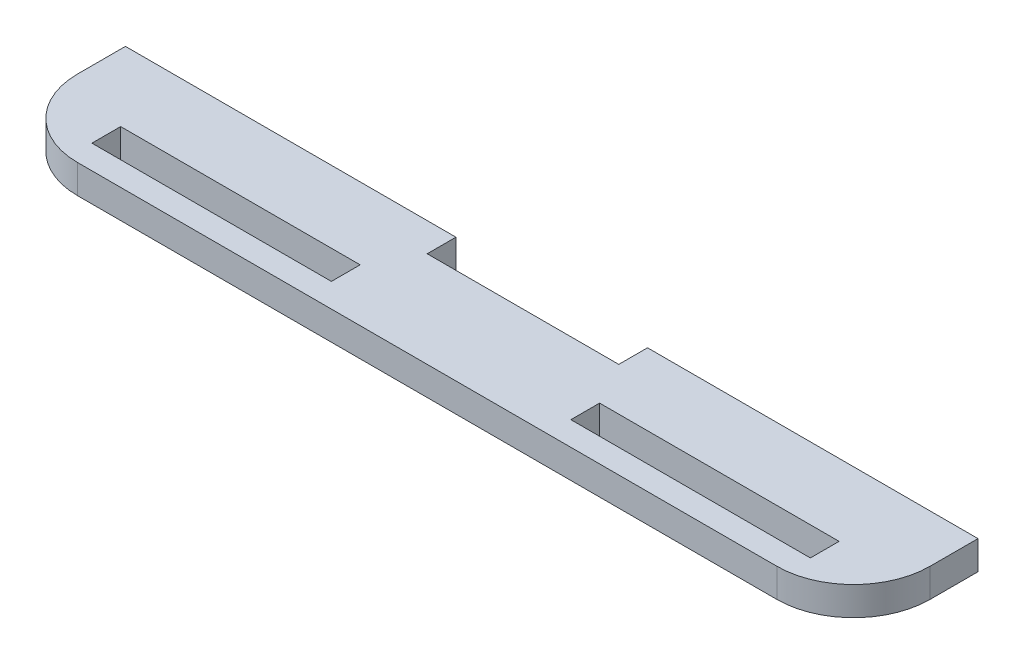
from build123d import *

# Parameters (mm, degrees)
ESTRUSIONE_ESTRUSIONE1_DEPTH      = 10
ESTRUSIONE_ESTRUSIONE1_DEPTH_BACK = 3
SCHIZZO1_W                        = 89
SCHIZZO1_H                        = 3
SCHIZZO2_W                        = 25
SCHIZZO2_H                        = 3
TAGLIO_ESTRUSIONE1_DEPTH          = 10
SCHIZZO3_W                        = 20
SCHIZZO3_H                        = 3
TAGLIO_ESTRUSIONE2_DEPTH          = 10
RACCORDO1_R                       = 8


with BuildPart() as part:
    # Schizzo1 → Estrusione-Estrusione1 (new, two sides: drawn at the far end of the back side and taken through both)
    with BuildSketch(Plane.XY.offset(-ESTRUSIONE_ESTRUSIONE1_DEPTH_BACK)):
        with Locations((0, 22.5)):
            Rectangle(SCHIZZO1_W, SCHIZZO1_H)
    extrude(amount=ESTRUSIONE_ESTRUSIONE1_DEPTH + ESTRUSIONE_ESTRUSIONE1_DEPTH_BACK)

    # Schizzo2 → Taglio-Estrusione1 (cut)
    with BuildSketch(Plane.XZ.offset(-21)):
        with Locations((-25, 6)):
            Rectangle(SCHIZZO2_W, SCHIZZO2_H)
        with Locations((25, 6)):
            Rectangle(SCHIZZO2_W, SCHIZZO2_H)
    extrude(amount=-TAGLIO_ESTRUSIONE1_DEPTH, mode=Mode.SUBTRACT)

    # Schizzo3 → Taglio-Estrusione2 (cut)
    with BuildSketch(Plane(origin=(0, 24, 0), x_dir=(1, 0, 0), z_dir=(0, 1, 0))):
        with Locations((0, 1.5)):
            Rectangle(SCHIZZO3_W, SCHIZZO3_H)
    extrude(amount=-TAGLIO_ESTRUSIONE2_DEPTH, mode=Mode.SUBTRACT)

    # Raccordo1
    raccordo1_edges = [part.edges().sort_by_distance(p)[0] for p in [
        (-44.5, 22.5, 10),
        (44.5, 22.5, 10),
    ]]
    fillet(raccordo1_edges, radius=RACCORDO1_R)


solid = part.part
